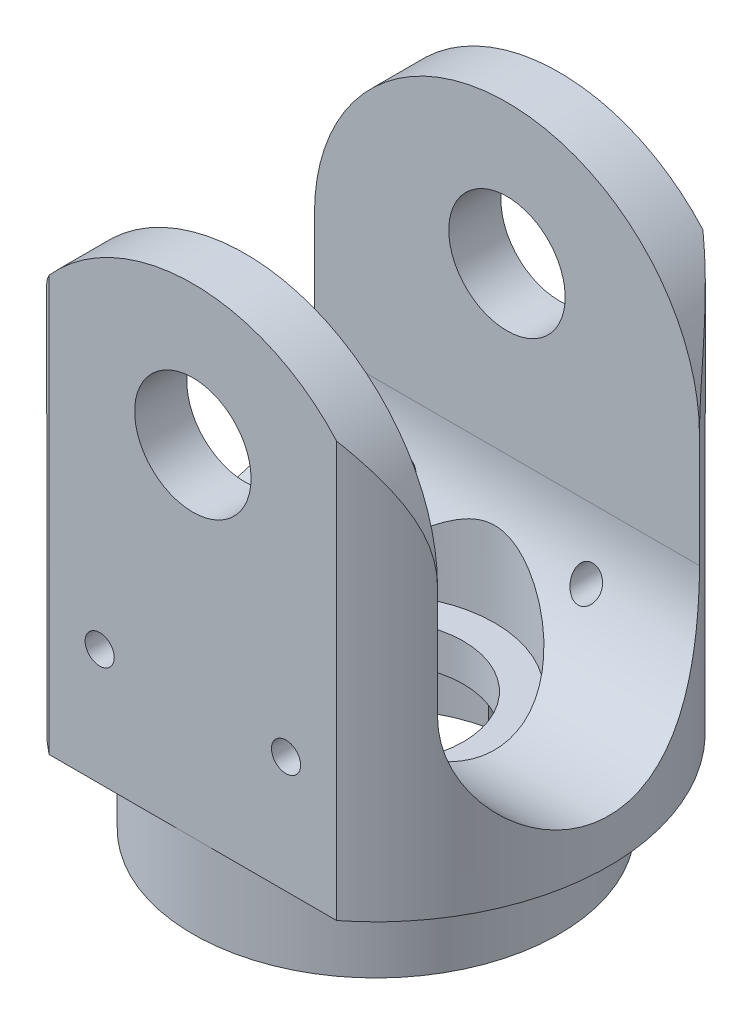
from build123d import *

# Parameters (mm, degrees)
BOSS_EXTRUDE1_DEPTH      = 15.367
BOSS_EXTRUDE1_DEPTH_BACK = 15.367
SKETCH1_R                = 12.7
SKETCH4_W                = 25.4
SKETCH4_H                = 30.734
CUT_EXTRUDE2_DEPTH       = 31.202731501
CUT_EXTRUDE3_DEPTH       = 23.298112478
CUT_EXTRUDE3_DEPTH_BACK  = 23.298112478
SKETCH5_W                = 14.2875
SKETCH5_H                = 16.637
CUT_EXTRUDE4_DEPTH       = 29.222672145
SKETCH7_R                = 4.7625
CUT_EXTRUDE5_DEPTH       = 35.722325639
SKETCH9_R                = 17.852773039
SKETCH9_R_2              = 9.9822
CUT_EXTRUDE6_DEPTH       = 4.572
SKETCH10_R               = 6.477
CUT_EXTRUDE7_DEPTH       = 24.257
SKETCH11_R               = 3.175
CUT_EXTRUDE8_DEPTH       = 29.222672145
CUT_EXTRUDE9_DEPTH       = 29.222672145
CUT_EXTRUDE9_DEPTH_BACK  = 29.222672145
SKETCH12_R               = 0.79375
SKETCH15_R               = 4.7625
CUT_EXTRUDE12_DEPTH      = 4.445
SKETCH16_R               = 1.5875
CUT_EXTRUDE13_DEPTH      = 4.445


with BuildPart() as part:
    # Sketch1 → Boss-Extrude1 (new, two sides: drawn at the far end of the back side and taken through both)
    with BuildSketch(Plane(origin=(0, 0, 0), x_dir=(1, 0, 0), z_dir=(0, 1, 0)).offset(-BOSS_EXTRUDE1_DEPTH_BACK)):
        with Locations(Location((0, 0, 0), (0, 0, 270))):
            Circle(SKETCH1_R)
    extrude(amount=BOSS_EXTRUDE1_DEPTH + BOSS_EXTRUDE1_DEPTH_BACK)

    # Sketch4 → Cut-Extrude2 (cut, through all)
    with BuildSketch(Plane.XY.offset(9.98855)):
        Rectangle(SKETCH4_W, SKETCH4_H)
    cut_extrude2 = extrude(amount=CUT_EXTRUDE2_DEPTH, mode=Mode.SUBTRACT)

    # Mirror2: Cut-Extrude2 across plane
    add(cut_extrude2.mirror(Plane.XY), mode=Mode.SUBTRACT)

    # Sketch5 → Cut-Extrude3 (cut, two sides: drawn at the far end of the back side and taken through both)
    with BuildSketch(Plane(origin=(0, 0, 0), x_dir=(0, 0, -1), z_dir=(1, 0, 0)).offset(-CUT_EXTRUDE3_DEPTH_BACK)):
        with Locations((0, 7.0485)):
            Rectangle(SKETCH5_W, SKETCH5_H)
        with BuildLine():
            Line((7.14375, -1.27), (-7.14375, -1.27))
            ThreePointArc((-7.14375, -1.27), (0, -8.41375), (7.14375, -1.27))
        make_face()
    extrude(amount=CUT_EXTRUDE3_DEPTH + CUT_EXTRUDE3_DEPTH_BACK, mode=Mode.SUBTRACT)

    # Sketch6 → Cut-Extrude4 (cut, through all)
    with BuildSketch(Plane.XY.offset(9.98855)):
        with BuildLine():
            ThreePointArc((7.843396515, 11.847950137), (9.813665145, 8.601547837), (10.50036, 4.86664))
            Line((10.50036, 4.86664), (14.849727138, 4.86664))
            ThreePointArc((14.849727138, 4.86664), (0, 19.716367138), (-14.849727138, 4.86664))
            Line((-14.849727138, 4.86664), (-10.50036, 4.86664))
            ThreePointArc((-10.50036, 4.86664), (-9.813665145, 8.601547837), (-7.843396515, 11.847950137))
            Line((-7.843396515, 11.847950137), (-7.843396515, 15.367))
            Line((-7.843396515, 15.367), (0, 15.367))
            Line((0, 15.367), (7.843396515, 15.367))
            Line((7.843396515, 15.367), (7.843396515, 11.847950137))
        make_face()
        with BuildLine():
            ThreePointArc((-7.843396515, 11.847950137), (-4.298330514, 14.446927831), (0, 15.367))
            Line((0, 15.367), (-7.843396515, 15.367))
            Line((-7.843396515, 15.367), (-7.843396515, 11.847950137))
        make_face()
        with BuildLine():
            ThreePointArc((0, 15.367), (4.298330514, 14.446927831), (7.843396515, 11.847950137))
            Line((7.843396515, 11.847950137), (7.843396515, 15.367))
            Line((7.843396515, 15.367), (0, 15.367))
        make_face()
    extrude(amount=-CUT_EXTRUDE4_DEPTH, mode=Mode.SUBTRACT)

    # Sketch7 → Cut-Extrude5 (cut, through all)
    with BuildSketch(Plane.XZ.offset(15.367)):
        with Locations(Location((0, 0, 0), (0, 0, 270))):
            Circle(SKETCH7_R)
    extrude(amount=-CUT_EXTRUDE5_DEPTH, mode=Mode.SUBTRACT)

    # Sketch9 → Cut-Extrude6 (cut)
    with BuildSketch(Plane.XZ.offset(15.367)):
        Circle(SKETCH9_R)
        with Locations(Location((0, 0, 0), (0, 0, 270))):
            Circle(SKETCH9_R_2, mode=Mode.SUBTRACT)
    extrude(amount=-CUT_EXTRUDE6_DEPTH, mode=Mode.SUBTRACT)

    # Sketch10 → Cut-Extrude7 (cut)
    with BuildSketch(Plane(origin=(0, 15.367, 0), x_dir=(1, 0, 0), z_dir=(0, 1, 0))):
        with Locations(Location((0, 0, 0), (0, 0, 270))):
            Circle(SKETCH10_R)
    extrude(amount=-CUT_EXTRUDE7_DEPTH, mode=Mode.SUBTRACT)

    # Sketch11 → Cut-Extrude8 (cut, through all)
    with BuildSketch(Plane.XY.offset(9.98855)):
        with Locations(Location((0, 7.747, 0), (0, 0, 270))):
            Circle(SKETCH11_R)
    extrude(amount=-CUT_EXTRUDE8_DEPTH, mode=Mode.SUBTRACT)

    # Sketch12 → Cut-Extrude9 (cut, two sides: drawn at the far end of the back side and taken through both)
    with BuildSketch(Plane(origin=(0, 0, -9.98855), x_dir=(-1, 0, 0), z_dir=(0, 0, -1)).offset(-CUT_EXTRUDE9_DEPTH_BACK)):
        with Locations((5.081146515, -4.445)):
            Circle(SKETCH12_R)
        with Locations((-5.081146515, -4.445)):
            Circle(SKETCH12_R)
    extrude(amount=CUT_EXTRUDE9_DEPTH + CUT_EXTRUDE9_DEPTH_BACK, mode=Mode.SUBTRACT)

    # Sketch15 → Cut-Extrude12 (cut)
    with BuildSketch(Plane.XZ.offset(15.367)):
        with BuildLine():
            ThreePointArc((8.001, 0), (-5.572105758, 5.741745241), (-0.239879494, -7.997403255))
            Line((-0.239879494, -7.997403255), (7.597144444, -2.509860017))
            ThreePointArc((7.597144444, -2.509860017), (7.899390916, -1.271072049), (8.001, 0))
        make_face()
        with Locations(Location((0, 0, 0), (0, 0, 270))):
            Circle(SKETCH15_R, mode=Mode.SUBTRACT)
    extrude(amount=-CUT_EXTRUDE12_DEPTH, mode=Mode.SUBTRACT)

    # Sketch16 → Cut-Extrude13 (cut)
    with BuildSketch(Plane.XZ.offset(15.367)):
        with Locations((-0.217023554, -7.235403255)):
            Circle(SKETCH16_R)
        with Locations((6.873606877, -2.270825729)):
            Circle(SKETCH16_R)
    extrude(amount=-CUT_EXTRUDE13_DEPTH, mode=Mode.SUBTRACT)


solid = part.part
